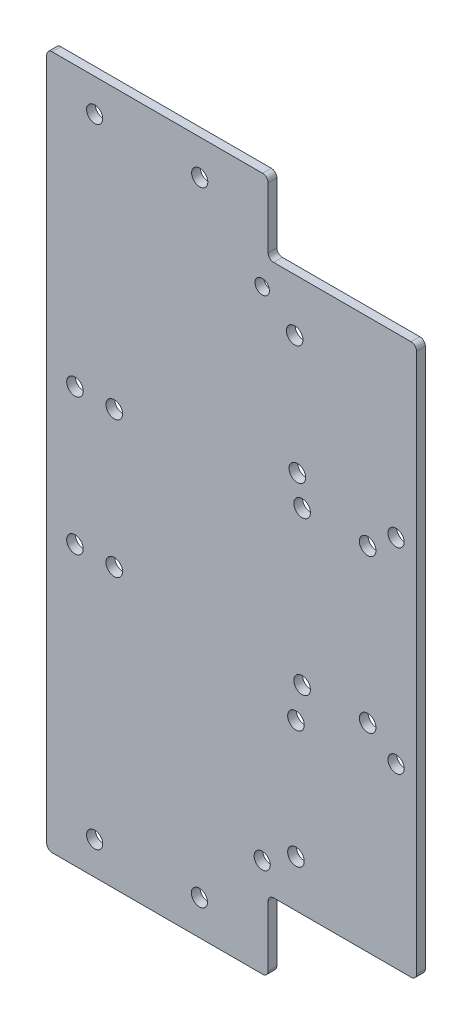
from build123d import *

# Parameters (mm, degrees)
SKETCH2_R               = 2.3495
SKETCH2_R_2             = 2.0955
BOSS_EXTRUDE1_DEPTH     = 2.54
SKETCH3_W               = 31.75
SKETCH3_H               = 44.323
BOSS_EXTRUDE2_DEPTH     = 2.54
SKETCH4_R               = 2.413
CUT_EXTRUDE1_DEPTH      = 238.743265275
SKETCH5_R               = 2.413
CUT_EXTRUDE2_DEPTH      = 238.743265275
SKETCH6_R               = 2.413
CUT_EXTRUDE3_DEPTH      = 238.743265275
SKETCH7_R               = 2.413
CUT_EXTRUDE4_DEPTH      = 238.743265275
SKETCH8_W               = 7.994763
SKETCH8_H               = 21.113506736
SKETCH8_W_2             = 21.493659396
SKETCH8_H_2             = 28.960940125
CUT_EXTRUDE5_DEPTH      = 238.743265275
CUT_EXTRUDE6_DEPTH      = 238.743265275
CUT_EXTRUDE6_DEPTH_BACK = 238.743265275
CUT_EXTRUDE7_REACH      = 206.142
SKETCH10_R              = 2.3495
FILLET1_R               = 1.5875


with BuildPart() as part:
    # Sketch2 → Boss-Extrude1 (new body)
    with BuildSketch(Plane(origin=(0, 0, 0), x_dir=(-1, 0, 0), z_dir=(0, 0, 1))):
        Polygon((-2.930050059, 168.708281075), (38.709428475, 168.708281075), (38.709428475, 189.536281075), (143.497061781, 189.536281075), (104.617436481, 110.859781075), (72.867436481, 110.859781075), (72.867436481, 66.536781075), (104.617436481, 66.536781075), (143.497061781, -12.139718925), (38.709428475, -12.139718925), (38.709428475, 8.688281075), (-2.930050059, 8.688281075), align=None)
        with Locations(Location((41.95655448, 160.961281075, 0), (0, 0, 180))):
            Circle(SKETCH2_R, mode=Mode.SUBTRACT)
        with Locations(Location((90.673911143, 180.011281075, 0), (0, 0, 180))):
            Circle(SKETCH2_R, mode=Mode.SUBTRACT)
        with Locations(Location((90.673911143, -2.614718925, 0), (0, 0, 180))):
            Circle(SKETCH2_R, mode=Mode.SUBTRACT)
        with Locations(Location((3.035061781, 117.209781075, 0), (0, 0, 180))):
            Circle(SKETCH2_R, mode=Mode.SUBTRACT)
        with Locations(Location((3.035061781, 60.186781075, 0), (0, 0, 180))):
            Circle(SKETCH2_R, mode=Mode.SUBTRACT)
        with Locations(Location((41.95655448, 16.435281075, 0), (0, 0, 180))):
            Circle(SKETCH2_R_2, mode=Mode.SUBTRACT)
    extrude(amount=BOSS_EXTRUDE1_DEPTH)

    # Sketch3 → Boss-Extrude2 (add)
    with BuildSketch(Plane.XY.offset(2.54)):
        with Locations((-88.742436481, -88.698281075)):
            Rectangle(SKETCH3_W, SKETCH3_H)
    extrude(amount=-BOSS_EXTRUDE2_DEPTH)

    # Sketch4 → Cut-Extrude1 (cut, through all)
    with BuildSketch(Plane.XY.offset(2.54)):
        with Locations((-96.39567787, -68.835481075)):
            Circle(SKETCH4_R)
        with Locations((-84.96567787, -68.835481075)):
            Circle(SKETCH4_R)
        with Locations((-30.343949941, -66.422481075)):
            Circle(SKETCH4_R)
        with Locations((-11.293949941, -66.422481075)):
            Circle(SKETCH4_R)
        with Locations(Location((-11.293949941, -110.974081075, 0), (0, 0, 180))):
            Circle(SKETCH4_R)
        with Locations(Location((-30.343949941, -110.974081075, 0), (0, 0, 180))):
            Circle(SKETCH4_R)
        with Locations(Location((-84.96567787, -108.561081075, 0), (0, 0, 180))):
            Circle(SKETCH4_R)
        with Locations(Location((-96.39567787, -108.561081075, 0), (0, 0, 180))):
            Circle(SKETCH4_R)
    extrude(amount=-CUT_EXTRUDE1_DEPTH, mode=Mode.SUBTRACT)

    # Sketch5 → Cut-Extrude2 (cut, through all)
    with BuildSketch(Plane.XY.offset(2.54)):
        with Locations((-31.738991634, -58.273080522)):
            Circle(SKETCH5_R)
    extrude(amount=-CUT_EXTRUDE2_DEPTH, mode=Mode.SUBTRACT)

    # Sketch6 → Cut-Extrude3 (cut, through all)
    with BuildSketch(Plane.XY.offset(2.54)):
        with Locations((-32.511395831, -23.991781075)):
            Circle(SKETCH6_R)
    extrude(amount=-CUT_EXTRUDE3_DEPTH, mode=Mode.SUBTRACT)

    # Sketch7 → Cut-Extrude4 (cut, through all)
    with BuildSketch(Plane.XY.offset(2.54)):
        with Locations((-32.140467993, -155.071444629)):
            Circle(SKETCH7_R)
        with Locations((-32.140467993, -120.781444629)):
            Circle(SKETCH7_R)
    extrude(amount=-CUT_EXTRUDE4_DEPTH, mode=Mode.SUBTRACT)

    # Sketch8 → Cut-Extrude5 (cut, through all)
    with BuildSketch(Plane.XY.offset(2.54)):
        with Locations((-36.236046975, 1.868472293)):
            Rectangle(SKETCH8_W, SKETCH8_H)
        with Locations((-29.486598777, -183.188751137)):
            Rectangle(SKETCH8_W_2, SKETCH8_H_2)
    extrude(amount=-CUT_EXTRUDE5_DEPTH, mode=Mode.SUBTRACT)

    # Sketch9 → Cut-Extrude6 (cut, two sides: drawn at the far end of the back side and taken through both)
    with BuildSketch(Plane.XY.offset(2.54).offset(-CUT_EXTRUDE6_DEPTH_BACK)):
        Polygon((-104.617436481, -66.536781075), (-104.617436481, 15.636566552), (-183.179161499, 15.636566552), (-188.262141255, -199.721259961), (-104.617436481, -202.664037714), align=None)
    extrude(amount=CUT_EXTRUDE6_DEPTH + CUT_EXTRUDE6_DEPTH_BACK, mode=Mode.SUBTRACT)

    # Sketch10 → Cut-Extrude7 (cut, up to next)
    with BuildSketch(Plane(origin=(-13.551580143, -6.849856516, 2.54), x_dir=(-0.9999147240311792, 0.01305927508136085, 0), z_dir=(0, 0, 1)), mode=Mode.PRIVATE) as cut_extrude7_sk1:
        with Locations(Location((46.679311403, -8.178590001, 0), (0, 0, 180.748262615))):
            Circle(SKETCH10_R)
    cut_extrude7_tool1 = extrude(cut_extrude7_sk1.sketch, amount=-CUT_EXTRUDE7_REACH, mode=Mode.PRIVATE) & part.part
    # Sketch10 → Cut-Extrude7 (cut, up to next)
    with BuildSketch(Plane(origin=(-13.551580143, -6.849856516, 2.54), x_dir=(-0.9999147240311792, 0.01305927508136085, 0), z_dir=(0, 0, 1)), mode=Mode.PRIVATE) as cut_extrude7_sk2:
        with Locations(Location((44.406688666, 173.16194469, 0), (0, 0, 180.748262615))):
            Circle(SKETCH10_R)
    cut_extrude7_tool2 = extrude(cut_extrude7_sk2.sketch, amount=-CUT_EXTRUDE7_REACH, mode=Mode.PRIVATE) & part.part
    add(cut_extrude7_tool1.solids().sort_by_distance((-60.120104, 1.937634, 2.54))[0], mode=Mode.SUBTRACT)
    add(cut_extrude7_tool2.solids().sort_by_distance((-60.215851, -179.417115, 2.54))[0], mode=Mode.SUBTRACT)

    # Fillet1
    fillet1_edges = [part.edges().sort_by_distance(p)[0] for p in [
        (-40.233428475, -189.536281075, 1.27),
        (-40.233428475, 12.139718925, 1.27),
        (-40.233428475, -8.688281075, 1.27),
        (-40.233428475, -168.708281075, 1.27),
        (-104.617436481, -189.536281075, 1.27),
        (-104.617436481, 12.139718925, 1.27),
        (2.930050059, -168.708281075, 1.27),
        (2.930050059, -8.688281075, 1.27),
    ]]
    fillet(fillet1_edges, radius=FILLET1_R)


solid = part.part
